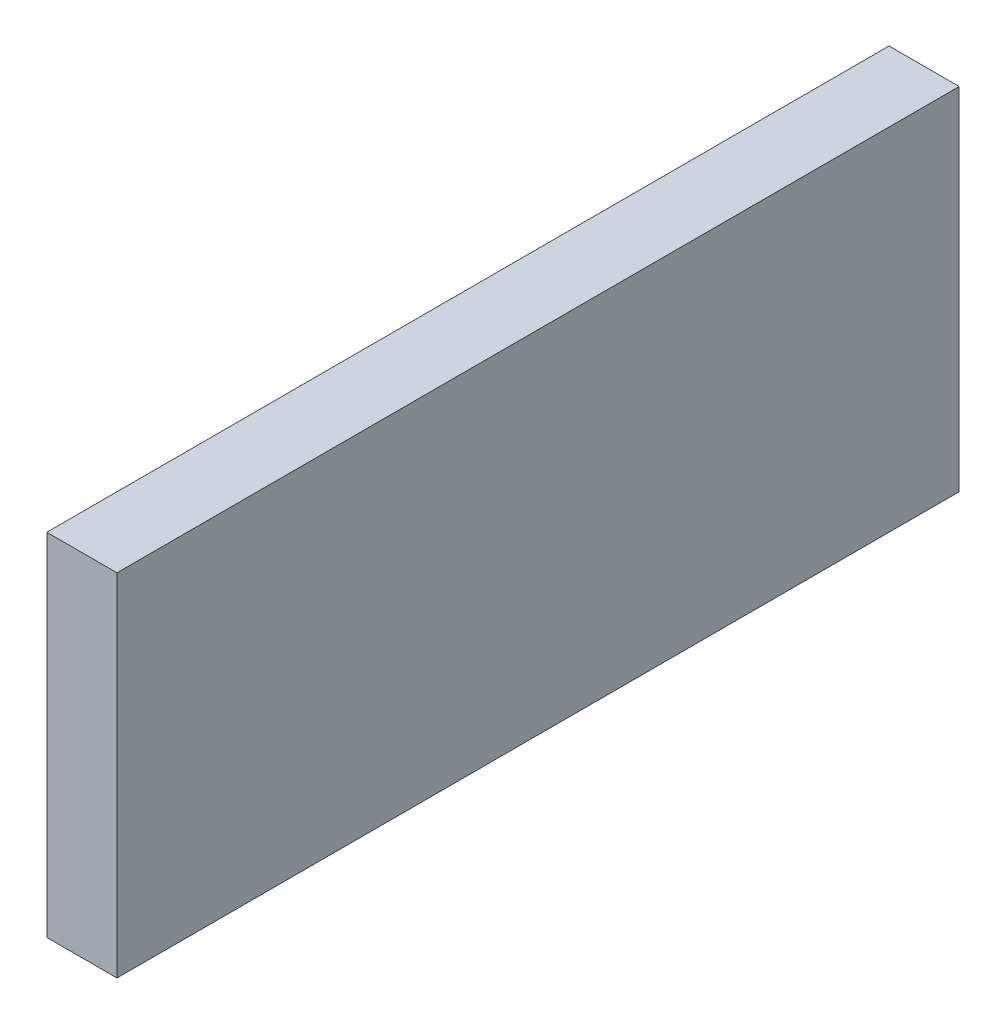
from build123d import *

# Parameters (mm, degrees)
SKETCH_1_W      = 20
SKETCH_1_H      = 240
EXTRUDE_1_DEPTH = 100


with BuildPart() as part:
    # 草图1 → 凸台-拉伸1 (new body)
    with BuildSketch(Plane(origin=(0, 0, 0), x_dir=(1, 0, 0), z_dir=(0, 1, 0))):
        with Locations((10, -120)):
            Rectangle(SKETCH_1_W, SKETCH_1_H)
    extrude(amount=EXTRUDE_1_DEPTH)


solid = part.part
